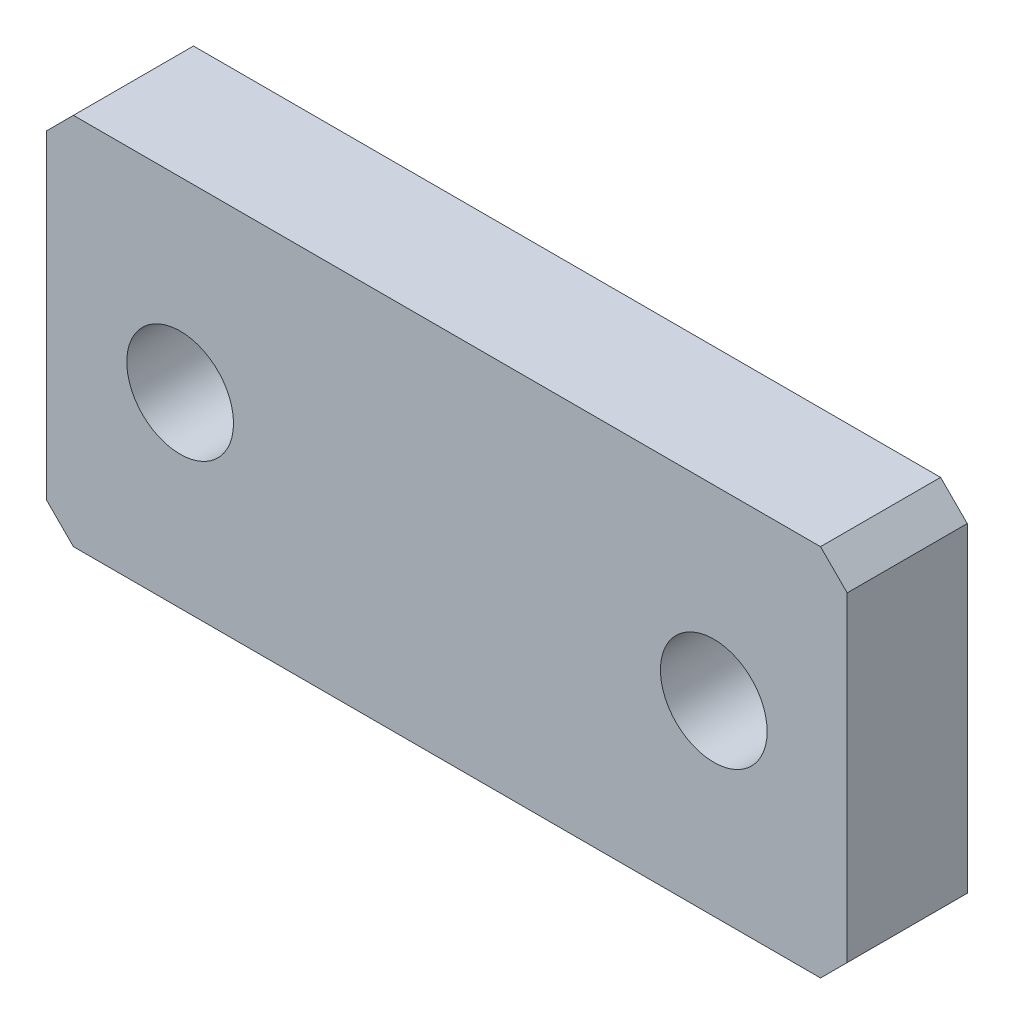
from build123d import *

# Parameters (mm, degrees)
SKETCH_1_R      = 2
EXTRUDE_1_DEPTH = 4.5


with BuildPart() as part:
    # 草图1 → 拉伸1 (new body)
    with BuildSketch(Plane.XY):
        Polygon((1281.32279317, 1001.256432472), (1253.32279317, 1001.256432472), (1252.32279317, 1000.256432472), (1252.32279317, 988.256432472), (1253.32279317, 987.256432472), (1281.32279317, 987.256432472), (1282.32279317, 988.256432472), (1282.32279317, 1000.256432472), align=None)
        with Locations((1257.32279317, 994.256432472)):
            Circle(SKETCH_1_R, mode=Mode.SUBTRACT)
        with Locations((1277.32279317, 994.256432472)):
            Circle(SKETCH_1_R, mode=Mode.SUBTRACT)
    extrude(amount=EXTRUDE_1_DEPTH)


solid = part.part
